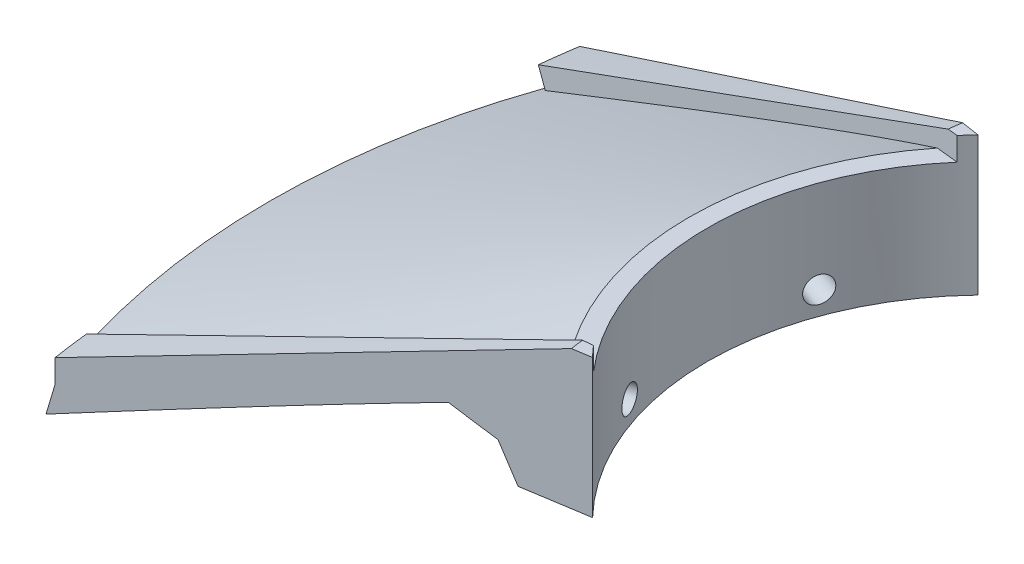
from build123d import *

# Parameters (mm, degrees)
RIVOLUZIONE1_ANGLE                 = 44
RIVOLUZIONE1_OTHER_WAY_ANGLE       = 44
TAGLIO_ESTRUSIONE1_DEPTH           = 59
FORO_PER_VITE_M4_1_D               = 5.6
FORO_PER_VITE_M4_1_DEPTH           = 8.1
FORO_PER_VITE_M4_1_TIP             = 1.682409733
FORO_PER_VITE_M4_1_ON_FACE_2_D     = 5.6
FORO_PER_VITE_M4_1_ON_FACE_2_DEPTH = 8.1
FORO_PER_VITE_M4_1_ON_FACE_2_TIP   = 1.682409733
RIVOLUZIONE2_ANGLE                 = 3
RIVOLUZIONE3_ANGLE                 = 3
TAGLIO_ESTRUSIONE2_START           = -59
SCHIZZO7_R                         = 60
TAGLIO_ESTRUSIONE2_DEPTH           = 59


with BuildPart() as part:
    # Schizzo1 → Rivoluzione1 (revolve)
    with BuildSketch(Plane(origin=(0, 0, 0), x_dir=(-1, 0, 0), z_dir=(0, 0, -1))):
        Polygon((83.801322108, 10.249602265), (156.30594507, -23.559858674), (154.630778704, -17.261826174), (64, 25), (60, 25), (60, 0), (72, 0), (75.34408852, 7.171420975), align=None)
    revolve(axis=Axis((0, 0, 0), (0, 1, 0)), revolution_arc=RIVOLUZIONE1_ANGLE)

    # Schizzo1 → Rivoluzione1 other way (revolve)
    with BuildSketch(Plane(origin=(0, 0, 0), x_dir=(-1, 0, 0), z_dir=(0, 0, -1))):
        Polygon((83.801322108, 10.249602265), (156.30594507, -23.559858674), (154.630778704, -17.261826174), (64, 25), (60, 25), (60, 0), (72, 0), (75.34408852, 7.171420975), align=None)
    revolve(axis=Axis((0, 0, 0), (0, -1, 0)), revolution_arc=RIVOLUZIONE1_OTHER_WAY_ANGLE)

    # Schizzo6 → Taglio-Estrusione1 (cut)
    with BuildSketch(Plane(origin=(0, 25, 0), x_dir=(1, 0, 0), z_dir=(0, 1, 0))):
        with BuildLine():
            Line((-43.16038802, 41.679502228), (-145.209485409, 57.842491403))
            ThreePointArc((-145.209485409, 57.842491403), (-131.297347075, 84.808932993), (-112.437087319, 108.579233096))
            Line((-112.437087319, 108.579233096), (-43.16038802, 41.679502228))
        make_face()
        with BuildLine():
            Line((-43.16038802, -41.679502228), (-145.209485409, -57.842491403))
            ThreePointArc((-145.209485409, -57.842491403), (-131.297347075, -84.808932993), (-112.437087319, -108.579233096))
            Line((-112.437087319, -108.579233096), (-43.16038802, -41.679502228))
        make_face()
    extrude(amount=-TAGLIO_ESTRUSIONE1_DEPTH, mode=Mode.SUBTRACT)

    # Foro per Vite M4-1
    with Locations(Plane(origin=(-56.381557247, 5, 20.5212086), x_dir=(0.342020143326, 0, 0.939692620786), z_dir=(0.939692620786, 0, -0.342020143326))):
        with Locations((0, 0)):
            Hole(FORO_PER_VITE_M4_1_D / 2, depth=FORO_PER_VITE_M4_1_DEPTH)
            with Locations((0, 0, -(FORO_PER_VITE_M4_1_DEPTH + FORO_PER_VITE_M4_1_TIP / 2))):  # 118° drill point
                Cone(0, FORO_PER_VITE_M4_1_D / 2, FORO_PER_VITE_M4_1_TIP, mode=Mode.SUBTRACT)

    # Foro per Vite M4-1 on face 2
    with Locations(Plane(origin=(-56.381557247, 5.000002473, -20.5212086), x_dir=(-0.342019894889, 0, 0.939692711209), z_dir=(0.939692711209, 0, 0.342019894889))):
        with Locations((0, 0)):
            Hole(FORO_PER_VITE_M4_1_ON_FACE_2_D / 2, depth=FORO_PER_VITE_M4_1_ON_FACE_2_DEPTH)
            with Locations((0, 0, -(FORO_PER_VITE_M4_1_ON_FACE_2_DEPTH + FORO_PER_VITE_M4_1_ON_FACE_2_TIP / 2))):  # 118° drill point
                Cone(0, FORO_PER_VITE_M4_1_ON_FACE_2_D / 2, FORO_PER_VITE_M4_1_ON_FACE_2_TIP, mode=Mode.SUBTRACT)

    # Schizzo2 → Rivoluzione2 (revolve)
    with BuildSketch(Plane(origin=(7.537525881, 0, -33.649741509), x_dir=(-0.9876883405951378, 0, -0.15643446504023117), z_dir=(0.15643446504023117, 0, -0.9876883405951378))):
        Polygon((51.329869775, 25), (51.329869775, 30), (55.329869775, 30), (154.933952788, -12.679561819), (152.933239569, -17.261826174), (56.140326971, 25), align=None)
    revolve(axis=Axis((5.383627379, 0, -33.990885517), (0, 1, 0)), revolution_arc=RIVOLUZIONE2_ANGLE)

    # Schizzo3 → Rivoluzione3 (revolve)
    with BuildSketch(Plane(origin=(7.537525881, 0, 33.649741509), x_dir=(0.9876883405951378, 0, -0.15643446504023112), z_dir=(0.15643446504023112, 0, 0.9876883405951378))):
        Polygon((-51.329869775, 25), (-56.140326971, 25), (-152.933239569, -17.261826174), (-152.933239569, -12.261826174), (-55.329869775, 30), (-51.329869775, 30), align=None)
    revolve(axis=Axis((5.383627379, 0, 33.990885517), (0, -1, 0)), revolution_arc=RIVOLUZIONE3_ANGLE)

    # Schizzo7 → Taglio-Estrusione2 (cut)
    with BuildSketch(Plane(origin=(0, 30, 0), x_dir=(1, 0, 0), z_dir=(0, 1, 0)).offset(TAGLIO_ESTRUSIONE2_START)):
        Circle(SCHIZZO7_R)
    extrude(amount=TAGLIO_ESTRUSIONE2_DEPTH, mode=Mode.SUBTRACT)


solid = part.part
